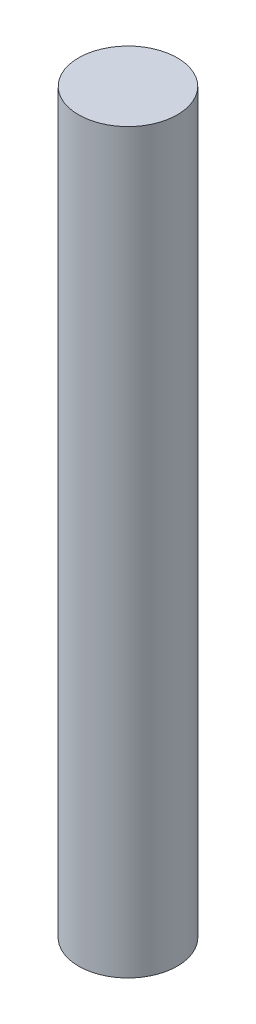
from build123d import *

# Parameters (mm, degrees)
ESBO_O1_R                  = 0.595
FINGEQUEEHUMPARAFUSO_DEPTH = 8.887218917


with BuildPart() as part:
    # Esboço1 → FingeQueEhUmParafuso (new body)
    with BuildSketch(Plane(origin=(0, 0, 0), x_dir=(1, 0, 0), z_dir=(0, 1, 0))):
        with Locations(Location((0, 0, 0), (0, 0, 270))):
            Circle(ESBO_O1_R)
    extrude(amount=FINGEQUEEHUMPARAFUSO_DEPTH)


solid = part.part
